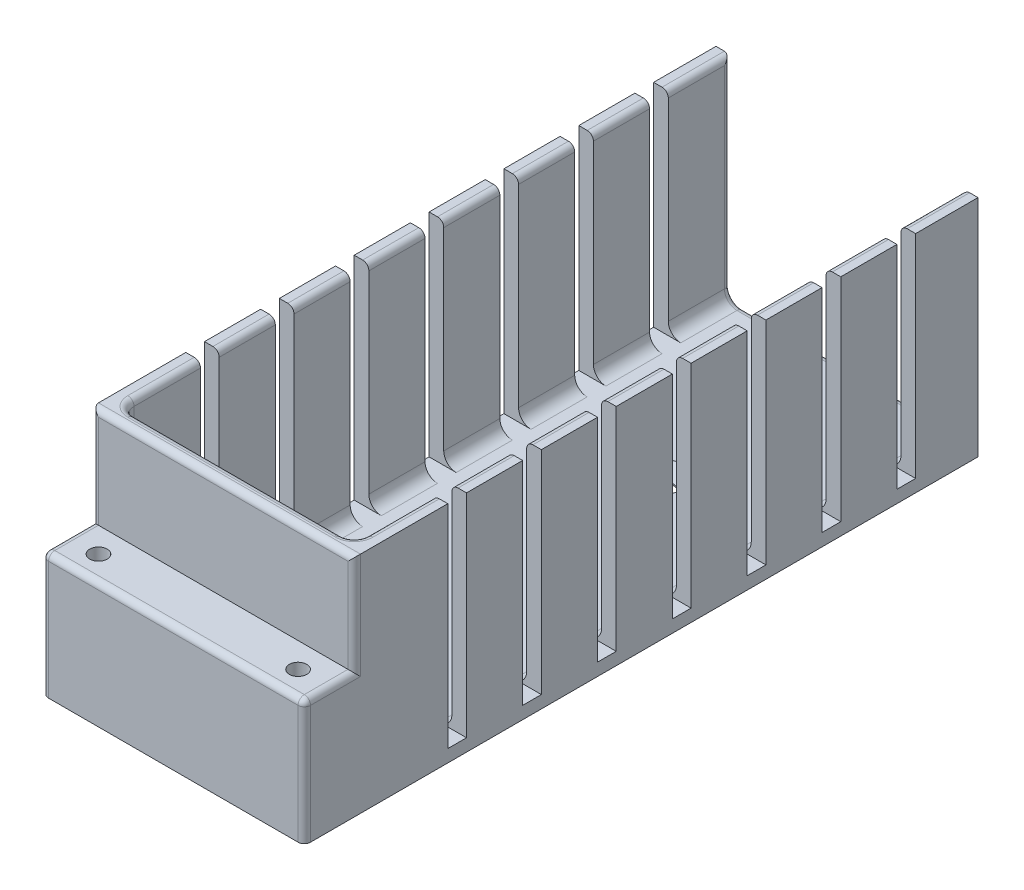
from build123d import *

# Parameters (mm, degrees)
SKETCH1_W                                      = 42
SKETCH1_H                                      = 100
BOSS_EXTRUDE1_DEPTH                            = 2
BOSS_EXTRUDE2_DEPTH                            = 34
FILLET1_R                                      = 2
CUT_EXTRUDE1_REACH                             = 67.092
SKETCH3_W                                      = 42
SKETCH3_H                                      = 3
LPATTERN1_COUNT                                = 7
LPATTERN1_PITCH                                = 12
CSK_FOR_M3_FLAT_HEAD_MACHINE_SCREW1_AT_2_COUNT = 2
CSK_FOR_M3_FLAT_HEAD_MACHINE_SCREW1_AT_2_PITCH = 40
SKETCH7_W                                      = 42
SKETCH7_H                                      = 8
SKETCH7_R                                      = 1.4
BOSS_EXTRUDE3_DEPTH                            = 20
FILLET2_R                                      = 1


with BuildPart() as part:
    # Sketch1 → Boss-Extrude1 (new body)
    with BuildSketch(Plane(origin=(0, 0, 0), x_dir=(1, 0, 0), z_dir=(0, 1, 0))):
        Rectangle(SKETCH1_W, SKETCH1_H)
    extrude(amount=BOSS_EXTRUDE1_DEPTH)

    # Sketch2 → Boss-Extrude2 (add)
    with BuildSketch(Plane(origin=(0, 2, 0), x_dir=(1, 0, 0), z_dir=(0, 1, 0))):
        Polygon((-21, 50), (-18.65, 50), (-18.65, -47.65), (18.65, -47.65), (18.65, 50), (21, 50), (21, -50), (-21, -50), align=None)
    extrude(amount=BOSS_EXTRUDE2_DEPTH)

    # Fillet1
    fillet1_edges = [part.edges().sort_by_distance(p)[0] for p in [
        (18.65, 2, -1.175),
        (0, 2, 47.65),
        (18.65, 19, 47.65),
        (-18.65, 2, -1.175),
        (-18.65, 19, 47.65),
    ]]
    fillet(fillet1_edges, radius=FILLET1_R)

    # Cut-Extrude1: up to this face of the body (flat: up to its plane)
    cut_extrude1_end = Plane(part.part.faces().sort_by_distance((0, 2, -2.175))[0])
    # Sketch3 → Cut-Extrude1 (cut, up to the picked face)
    with BuildSketch(Plane(origin=(0, 36, 0), x_dir=(1, 0, 0), z_dir=(0, 1, 0)), mode=Mode.PRIVATE) as cut_extrude1_sk1:
        with Locations((0, 38.5)):
            Rectangle(SKETCH3_W, SKETCH3_H)
    cut_extrude1_tool1 = split(extrude(cut_extrude1_sk1.sketch, amount=-CUT_EXTRUDE1_REACH, mode=Mode.PRIVATE), bisect_by=cut_extrude1_end, keep=Keep.BOTH, mode=Mode.PRIVATE)
    cut_extrude1 = cut_extrude1_tool1.solids().sort_by(Axis((0, 36, -38.5), (0, -1, 0)))[0]
    add(cut_extrude1, mode=Mode.SUBTRACT)

    # LPattern1: Cut-Extrude1 ×7
    with Locations(*[(0, 0, i * LPATTERN1_PITCH) for i in range(1, LPATTERN1_COUNT)]):
        add(cut_extrude1, mode=Mode.SUBTRACT)

    # Sketch5 → CSK for M3 Flat Head Machine Screw1 (revolve, cut)
    with BuildSketch(Plane(origin=(0.560724051, 2, -20), x_dir=(0, 0, 1), z_dir=(1, 0, 0))):
        Polygon((0, 0), (0, 2), (1.6, 2), (1.6, 1.775), (3.375, 0), align=None)
    csk_for_m3_flat_head_machine_screw1 = revolve(axis=Axis((0.560724051, 8.35, -20), (0, -1, 0)), mode=Mode.SUBTRACT)

    # CSK for M3 Flat Head Machine Screw1 at 2: CSK for M3 Flat Head Machine Screw1 ×2
    with Locations(*[(0, 0, i * CSK_FOR_M3_FLAT_HEAD_MACHINE_SCREW1_AT_2_PITCH) for i in range(1, CSK_FOR_M3_FLAT_HEAD_MACHINE_SCREW1_AT_2_COUNT)]):
        add(csk_for_m3_flat_head_machine_screw1, mode=Mode.SUBTRACT)

    # Sketch7 → Boss-Extrude3 (add)
    with BuildSketch(Plane.XZ):
        with Locations((0, 54)):
            Rectangle(SKETCH7_W, SKETCH7_H)
        with Locations(Location((-16, 54, 0), (0, 0, 270))):
            Circle(SKETCH7_R, mode=Mode.SUBTRACT)
        with Locations(Location((16, 54, 0), (0, 0, 270))):
            Circle(SKETCH7_R, mode=Mode.SUBTRACT)
    extrude(amount=-BOSS_EXTRUDE3_DEPTH)

    # Fillet2
    fillet2_edges = [part.edges().sort_by_distance(p)[0] for p in [
        (18.65, 36, -20.5),
        (18.65, 36, -8.5),
        (18.65, 36, 3.5),
        (18.65, 36, 15.5),
        (18.65, 36, 27.5),
        (18.65, 36, 40.325),
        (-18.65, 36, 27.5),
        (-18.65, 36, 15.5),
        (-18.65, 36, 3.5),
        (-18.65, 36, -8.5),
        (-18.65, 36, -20.5),
        (-18.65, 36, -32.5),
        (18.65, 20, -50),
        (-18.65, 20, -50),
        (0, 36, 50),
        (18.65, 36, -45),
        (-21, 20, 54),
        (0, 20, 58),
        (-21, 10, 58),
        (21, 20, 54),
        (21, 10, 58),
        (0, 36, 47.65),
        (-18.65, 36, 40.325),
        (0, 2, -50),
        (18.064213562, 36, 47.064213562),
        (-18.064213562, 36, 47.064213562),
        (18.064213562, 2.585786438, -50),
        (-18.064213562, 2.585786438, -50),
        (18.65, 36, -32.5),
        (-18.65, 36, -45),
        (21, 28, 50),
        (-21, 28, 50),
    ]]
    fillet(fillet2_edges, radius=FILLET2_R)


solid = part.part
